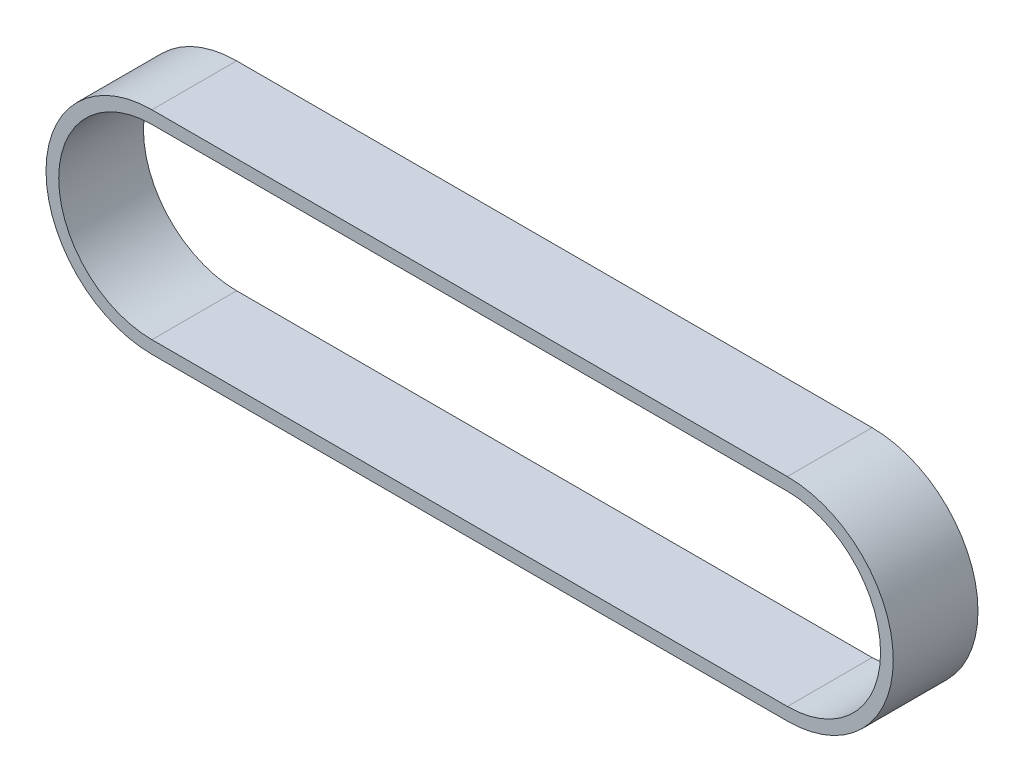
from build123d import *

# Parameters (mm, degrees)
EXTRUDE_THIN1_DEPTH = 20


with BuildPart() as part:
    # Sketch2 → Extrude-Thin1 (new, symmetric)
    with BuildSketch(Plane.XY):
        with BuildLine():
            Line((300.007045027, -49.957711456), (0.007048008, -49.999999503))
            ThreePointArc((0.007048008, -49.999999503), (-49.999999503, -0.007048008), (-0.007048008, 49.999999503))
            Line((-0.007048008, 49.999999503), (299.992949012, 50.04228755))
            ThreePointArc((299.992949012, 50.04228755), (349.999996523, 0.049336055), (300.007045027, -49.957711456))
        make_face()
        with BuildLine():
            Line((300.006199266, -43.957711516), (0.006202247, -43.999999563))
            ThreePointArc((0.006202247, -43.999999563), (-43.999999563, -0.006202247), (-0.006202247, 43.999999563))
            Line((-0.006202247, 43.999999563), (299.993794773, 44.04228761))
            ThreePointArc((299.993794773, 44.04228761), (343.999996582, 0.048490294), (300.006199266, -43.957711516))
        make_face(mode=Mode.SUBTRACT)
    extrude(amount=EXTRUDE_THIN1_DEPTH, both=True)


solid = part.part
